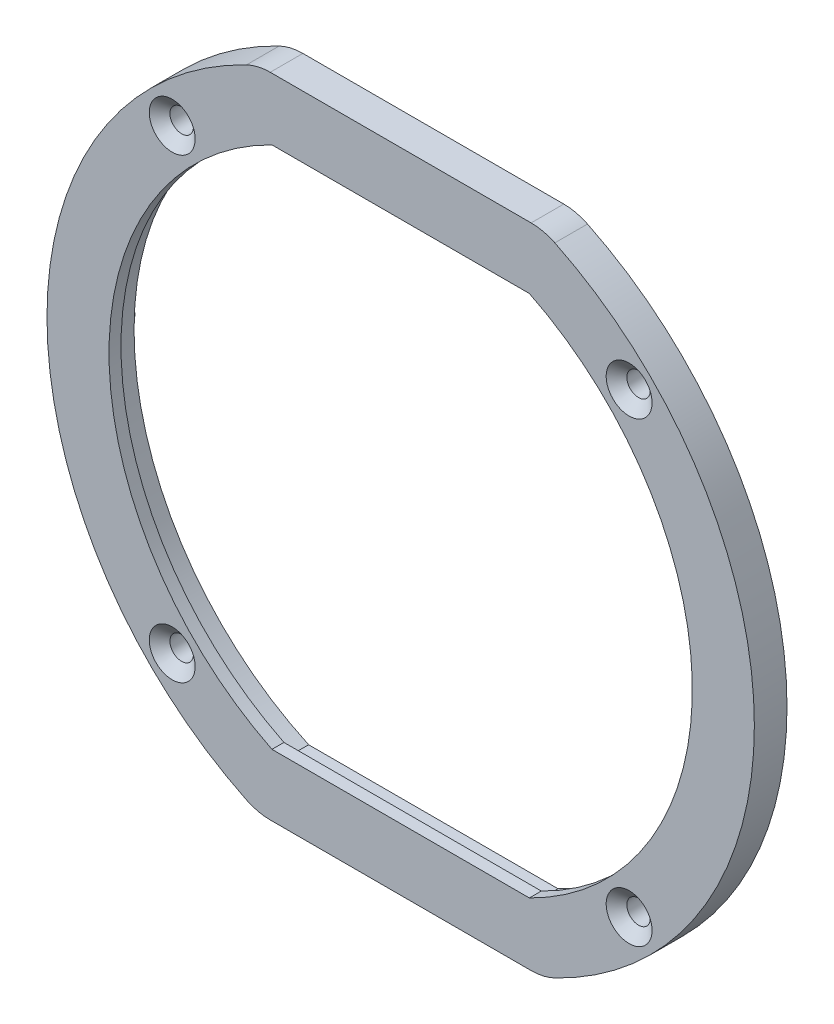
from build123d import *

# Parameters (mm, degrees)
BOSS_EXTRUDE1_DEPTH                               = 6
CSK_FOR_8_FLAT_HEAD_MACHINE_SCREW_100_D           = 4.3053
CSK_FOR_8_FLAT_HEAD_MACHINE_SCREW_100_CSINK_D     = 8.4328
CSK_FOR_8_FLAT_HEAD_MACHINE_SCREW_100_CSINK_ANGLE = 100
SKETCH5_R                                         = 1.905
BOSS_EXTRUDE2_DEPTH                               = 2.5
FILLET1_R                                         = 10
CUT_EXTRUDE1_DEPTH                                = 3.8


with BuildPart() as part:
    # Sketch1 → Boss-Extrude1 (new body)
    with BuildSketch(Plane.XY):
        with BuildLine():
            Line((-26.167728216, 59.5), (26.167728216, 59.5))
            ThreePointArc((26.167728216, 59.5), (65, 0), (26.167728216, -59.5))
            Line((26.167728216, -59.5), (-26.167728216, -59.5))
            ThreePointArc((-26.167728216, -59.5), (-65, 0), (-26.167728216, 59.5))
        make_face()
        with BuildLine():
            Line((-23.650581388, 48.1), (23.650581388, 48.1))
            ThreePointArc((23.650581388, 48.1), (53.6, 0), (23.650581388, -48.1))
            Line((23.650581388, -48.1), (-23.650581388, -48.1))
            ThreePointArc((-23.650581388, -48.1), (-53.6, 0), (-23.650581388, 48.1))
        make_face(mode=Mode.SUBTRACT)
    extrude(amount=BOSS_EXTRUDE1_DEPTH)

    # CSK for #8 Flat Head Machine Screw (100)1 (through all)
    with Locations(Plane.XY.offset(6)):
        with Locations((0, 0), (41.985, 41.985), (-41.985, -41.985), (-41.985, 41.985), (41.985, -41.985)):
            CounterSinkHole(CSK_FOR_8_FLAT_HEAD_MACHINE_SCREW_100_D / 2, CSK_FOR_8_FLAT_HEAD_MACHINE_SCREW_100_CSINK_D / 2, counter_sink_angle=CSK_FOR_8_FLAT_HEAD_MACHINE_SCREW_100_CSINK_ANGLE)

    # Sketch5 → Boss-Extrude2 (add)
    with BuildSketch(Plane(origin=(0, 0, 0), x_dir=(-1, 0, 0), z_dir=(0, 0, -1))):
        with Locations(Location((-59.2455, 0, 0), (0, 0, 180))):
            Circle(SKETCH5_R)
        with Locations(Location((59.2455, 0, 0), (0, 0, 180))):
            Circle(SKETCH5_R)
    extrude(amount=BOSS_EXTRUDE2_DEPTH)

    # Fillet1
    fillet1_edges = [part.edges().sort_by_distance(p)[0] for p in [
        (26.167728216, -59.5, 3),
        (-26.167728216, -59.5, 3),
        (-26.167728216, 59.5, 3),
        (26.167728216, 59.5, 3),
    ]]
    fillet(fillet1_edges, radius=FILLET1_R)

    # Sketch6 → Cut-Extrude1 (cut)
    with BuildSketch(Plane(origin=(0, 0, 0), x_dir=(-1, 0, 0), z_dir=(0, 0, -1))):
        with BuildLine():
            Line((22.912878475, 50), (-22.912878475, 50))
            ThreePointArc((-22.912878475, 50), (-55, 0), (-22.912878475, -50))
            Line((-22.912878475, -50), (22.912878475, -50))
            ThreePointArc((22.912878475, -50), (55, 0), (22.912878475, 50))
        make_face()
    extrude(amount=-CUT_EXTRUDE1_DEPTH, mode=Mode.SUBTRACT)


solid = part.part
